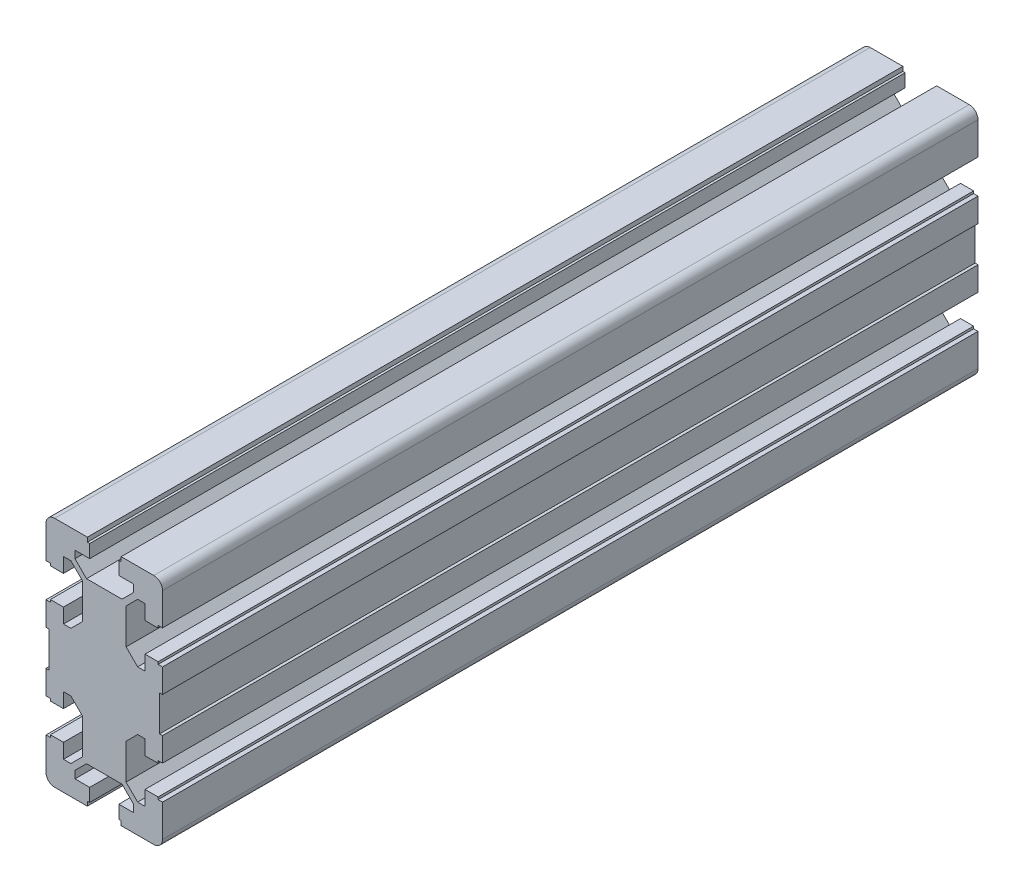
from build123d import *

# Parameters (mm, degrees)
EXTRUDE1_DEPTH      = 200
BOSS_EXTRUDE1_START = 80
BOSS_EXTRUDE1_DEPTH = 80


with BuildPart() as part:
    # Sketch1 → Extrude1 (new body)
    with BuildSketch(Plane.XY):
        with BuildLine():
            Line((19, -6.108412677), (20, -6.108412677))
            Line((20, -6.108412677), (20, -14.308412677))
            Line((20, -14.308412677), (18.5, -14.308412677))
            Line((18.5, -14.308412677), (18.5, -15.108412677))
            Line((18.5, -15.108412677), (14, -15.108412677))
            Line((14, -15.108412677), (14, -10.058412677))
            Line((14, -10.058412677), (11.464213562, -10.058412677))
            Line((11.464213562, -10.058412677), (7.5, -14.02262624))
            Line((7.5, -14.02262624), (7.5, -26.194199115))
            Line((7.5, -26.194199115), (11.464213562, -30.158412677))
            Line((11.464213562, -30.158412677), (14, -30.158412677))
            Line((14, -30.158412677), (14, -25.108412677))
            Line((14, -25.108412677), (18.5, -25.108412677))
            Line((18.5, -25.108412677), (18.5, -25.908412677))
            Line((18.5, -25.908412677), (20, -25.908412677))
            Line((20, -25.908412677), (20, -37))
            ThreePointArc((20, -37), (19.121320344, -39.121320344), (17, -40))
            Line((17, -40), (5.8, -40))
            Line((5.8, -40), (5.8, -38.5))
            Line((5.8, -38.5), (5, -38.5))
            Line((5, -38.5), (5, -34))
            Line((5, -34), (10.05, -34))
            Line((10.05, -34), (10.05, -31.464213562))
            Line((10.05, -31.464213562), (6.085786438, -27.5))
            Line((6.085786438, -27.5), (-6.085786438, -27.5))
            Line((-6.085786438, -27.5), (-10.05, -31.464213562))
            Line((-10.05, -31.464213562), (-10.05, -34))
            Line((-10.05, -34), (-5, -34))
            Line((-5, -34), (-5, -38.5))
            Line((-5, -38.5), (-5.8, -38.5))
            Line((-5.8, -38.5), (-5.8, -40))
            Line((-5.8, -40), (-17, -40))
            ThreePointArc((-17, -40), (-19.121320344, -39.121320344), (-20, -37))
            Line((-20, -37), (-20, -25.908412677))
            Line((-20, -25.908412677), (-18.5, -25.908412677))
            Line((-18.5, -25.908412677), (-18.5, -25.108412677))
            Line((-18.5, -25.108412677), (-14, -25.108412677))
            Line((-14, -25.108412677), (-14, -30.158412677))
            Line((-14, -30.158412677), (-11.464213562, -30.158412677))
            Line((-11.464213562, -30.158412677), (-7.5, -26.194199115))
            Line((-7.5, -26.194199115), (-7.5, -14.02262624))
            Line((-7.5, -14.02262624), (-11.464213562, -10.058412677))
            Line((-11.464213562, -10.058412677), (-14, -10.058412677))
            Line((-14, -10.058412677), (-14, -15.108412677))
            Line((-14, -15.108412677), (-18.5, -15.108412677))
            Line((-18.5, -15.108412677), (-18.5, -14.308412677))
            Line((-18.5, -14.308412677), (-20, -14.308412677))
            Line((-20, -14.308412677), (-20, -6.108412677))
            Line((-20, -6.108412677), (-19, -6.108412677))
            Line((-19, -6.108412677), (-19, 6.108412677))
            Line((-19, 6.108412677), (-20, 6.108412677))
            Line((-20, 6.108412677), (-20, 14.308412677))
            Line((-20, 14.308412677), (-18.5, 14.308412677))
            Line((-18.5, 14.308412677), (-18.5, 15.108412677))
            Line((-18.5, 15.108412677), (-14, 15.108412677))
            Line((-14, 15.108412677), (-14, 10.058412677))
            Line((-14, 10.058412677), (-11.464213562, 10.058412677))
            Line((-11.464213562, 10.058412677), (-7.5, 14.02262624))
            Line((-7.5, 14.02262624), (-7.5, 26.194199115))
            Line((-7.5, 26.194199115), (-11.464213562, 30.158412677))
            Line((-11.464213562, 30.158412677), (-14, 30.158412677))
            Line((-14, 30.158412677), (-14, 25.108412677))
            Line((-14, 25.108412677), (-18.5, 25.108412677))
            Line((-18.5, 25.108412677), (-18.5, 25.908412677))
            Line((-18.5, 25.908412677), (-20, 25.908412677))
            Line((-20, 25.908412677), (-20, 37))
            ThreePointArc((-20, 37), (-19.121320344, 39.121320344), (-17, 40))
            Line((-17, 40), (-5.8, 40))
            Line((-5.8, 40), (-5.8, 38.5))
            Line((-5.8, 38.5), (-5, 38.5))
            Line((-5, 38.5), (-5, 34))
            Line((-5, 34), (-10.05, 34))
            Line((-10.05, 34), (-10.05, 31.464213562))
            Line((-10.05, 31.464213562), (-6.085786438, 27.5))
            Line((-6.085786438, 27.5), (6.085786438, 27.5))
            Line((6.085786438, 27.5), (10.05, 31.464213562))
            Line((10.05, 31.464213562), (10.05, 34))
            Line((10.05, 34), (5, 34))
            Line((5, 34), (5, 38.5))
            Line((5, 38.5), (5.8, 38.5))
            Line((5.8, 38.5), (5.8, 40))
            Line((5.8, 40), (17, 40))
            ThreePointArc((17, 40), (19.121320344, 39.121320344), (20, 37))
            Line((20, 37), (20, 25.908412677))
            Line((20, 25.908412677), (18.5, 25.908412677))
            Line((18.5, 25.908412677), (18.5, 25.108412677))
            Line((18.5, 25.108412677), (14, 25.108412677))
            Line((14, 25.108412677), (14, 30.158412677))
            Line((14, 30.158412677), (11.464213562, 30.158412677))
            Line((11.464213562, 30.158412677), (7.5, 26.194199115))
            Line((7.5, 26.194199115), (7.5, 14.02262624))
            Line((7.5, 14.02262624), (11.464213562, 10.058412677))
            Line((11.464213562, 10.058412677), (14, 10.058412677))
            Line((14, 10.058412677), (14, 15.108412677))
            Line((14, 15.108412677), (18.5, 15.108412677))
            Line((18.5, 15.108412677), (18.5, 14.308412677))
            Line((18.5, 14.308412677), (20, 14.308412677))
            Line((20, 14.308412677), (20, 6.108412677))
            Line((20, 6.108412677), (19, 6.108412677))
            Line((19, 6.108412677), (19, -6.108412677))
        make_face()
        Polygon((10.635786438, -8.058412677), (17, -8.058412677), (17, 8.058412677), (10.635786438, 8.058412677), (6.085786438, 12.608412677), (-6.085786438, 12.608412677), (-10.635786438, 8.058412677), (-17, 8.058412677), (-17, -8.058412677), (-10.635786438, -8.058412677), (-6.085786438, -12.608412677), (6.085786438, -12.608412677), align=None, mode=Mode.SUBTRACT)
        with BuildLine():
            Line((-18.5, -34.608412677), (-18.5, -29.608412677))
            ThreePointArc((-18.5, -29.608412677), (-17, -28.108412677), (-15.5, -29.608412677))
            Line((-15.5, -29.608412677), (-15.5, -31.858412677))
            Line((-15.5, -31.858412677), (-14.5, -31.858412677))
            ThreePointArc((-14.5, -31.858412677), (-12.555456352, -32.663869029), (-11.75, -34.608412677))
            Line((-11.75, -34.608412677), (-11.75, -35.608412677))
            Line((-11.75, -35.608412677), (-9.5, -35.608412677))
            ThreePointArc((-9.5, -35.608412677), (-8, -37.108412677), (-9.5, -38.608412677))
            Line((-9.5, -38.608412677), (-14.5, -38.608412677))
            Line((-14.5, -38.608412677), (-14.5, -37.358412677))
            ThreePointArc((-14.5, -37.358412677), (-16.444543648, -36.552956325), (-17.25, -34.608412677))
            Line((-17.25, -34.608412677), (-18.5, -34.608412677))
        make_face(mode=Mode.SUBTRACT)
        with BuildLine():
            Line((5.5, -14.608412677), (2.397915762, -14.608412677))
            Line((2.397915762, -14.608412677), (1.998263135, -15.525079344))
            ThreePointArc((1.998263135, -15.525079344), (0, -15.108412677), (-1.998263135, -15.525079344))
            Line((-1.998263135, -15.525079344), (-2.397915762, -14.608412677))
            Line((-2.397915762, -14.608412677), (-5.5, -14.608412677))
            Line((-5.5, -14.608412677), (-5.5, -17.710496916))
            Line((-5.5, -17.710496916), (-4.583333333, -18.110149542))
            ThreePointArc((-4.583333333, -18.110149542), (-5, -20.108412677), (-4.583333333, -22.106675812))
            Line((-4.583333333, -22.106675812), (-5.5, -22.506328439))
            Line((-5.5, -22.506328439), (-5.5, -25.608412677))
            Line((-5.5, -25.608412677), (-2.397915762, -25.608412677))
            Line((-2.397915762, -25.608412677), (-1.998263135, -24.691746011))
            ThreePointArc((-1.998263135, -24.691746011), (0, -25.108412677), (1.998263135, -24.691746011))
            Line((1.998263135, -24.691746011), (2.397915762, -25.608412677))
            Line((2.397915762, -25.608412677), (5.5, -25.608412677))
            Line((5.5, -25.608412677), (5.5, -22.506328439))
            Line((5.5, -22.506328439), (4.583333333, -22.106675812))
            ThreePointArc((4.583333333, -22.106675812), (5, -20.108412677), (4.583333333, -18.110149542))
            Line((4.583333333, -18.110149542), (5.5, -17.710496916))
            Line((5.5, -17.710496916), (5.5, -14.608412677))
        make_face(mode=Mode.SUBTRACT)
        with BuildLine():
            Line((15.5, -31.858412677), (14.5, -31.858412677))
            ThreePointArc((14.5, -31.858412677), (12.555456352, -32.663869029), (11.75, -34.608412677))
            Line((11.75, -34.608412677), (11.75, -35.608412677))
            Line((11.75, -35.608412677), (9.5, -35.608412677))
            ThreePointArc((9.5, -35.608412677), (8, -37.108412677), (9.5, -38.608412677))
            Line((9.5, -38.608412677), (14.5, -38.608412677))
            Line((14.5, -38.608412677), (14.5, -37.358412677))
            ThreePointArc((14.5, -37.358412677), (16.444543648, -36.552956325), (17.25, -34.608412677))
            Line((17.25, -34.608412677), (18.5, -34.608412677))
            Line((18.5, -34.608412677), (18.5, -29.608412677))
            ThreePointArc((18.5, -29.608412677), (17, -28.108412677), (15.5, -29.608412677))
            Line((15.5, -29.608412677), (15.5, -31.858412677))
        make_face(mode=Mode.SUBTRACT)
        with BuildLine():
            Line((18.5, 34.608412677), (18.5, 29.608412677))
            ThreePointArc((18.5, 29.608412677), (17, 28.108412677), (15.5, 29.608412677))
            Line((15.5, 29.608412677), (15.5, 31.858412677))
            Line((15.5, 31.858412677), (14.5, 31.858412677))
            ThreePointArc((14.5, 31.858412677), (12.555456352, 32.663869029), (11.75, 34.608412677))
            Line((11.75, 34.608412677), (11.75, 35.608412677))
            Line((11.75, 35.608412677), (9.5, 35.608412677))
            ThreePointArc((9.5, 35.608412677), (8, 37.108412677), (9.5, 38.608412677))
            Line((9.5, 38.608412677), (14.5, 38.608412677))
            Line((14.5, 38.608412677), (14.5, 37.358412677))
            ThreePointArc((14.5, 37.358412677), (16.444543648, 36.552956325), (17.25, 34.608412677))
            Line((17.25, 34.608412677), (18.5, 34.608412677))
        make_face(mode=Mode.SUBTRACT)
        with BuildLine():
            Line((-5.5, 14.608412677), (-2.397915762, 14.608412677))
            Line((-2.397915762, 14.608412677), (-1.998263135, 15.525079344))
            ThreePointArc((-1.998263135, 15.525079344), (0, 15.108412677), (1.998263135, 15.525079344))
            Line((1.998263135, 15.525079344), (2.397915762, 14.608412677))
            Line((2.397915762, 14.608412677), (5.5, 14.608412677))
            Line((5.5, 14.608412677), (5.5, 17.710496916))
            Line((5.5, 17.710496916), (4.583333333, 18.110149542))
            ThreePointArc((4.583333333, 18.110149542), (5, 20.108412677), (4.583333333, 22.106675812))
            Line((4.583333333, 22.106675812), (5.5, 22.506328439))
            Line((5.5, 22.506328439), (5.5, 25.608412677))
            Line((5.5, 25.608412677), (2.397915762, 25.608412677))
            Line((2.397915762, 25.608412677), (1.998263135, 24.691746011))
            ThreePointArc((1.998263135, 24.691746011), (0, 25.108412677), (-1.998263135, 24.691746011))
            Line((-1.998263135, 24.691746011), (-2.397915762, 25.608412677))
            Line((-2.397915762, 25.608412677), (-5.5, 25.608412677))
            Line((-5.5, 25.608412677), (-5.5, 22.506328439))
            Line((-5.5, 22.506328439), (-4.583333333, 22.106675812))
            ThreePointArc((-4.583333333, 22.106675812), (-5, 20.108412677), (-4.583333333, 18.110149542))
            Line((-4.583333333, 18.110149542), (-5.5, 17.710496916))
            Line((-5.5, 17.710496916), (-5.5, 14.608412677))
        make_face(mode=Mode.SUBTRACT)
        with BuildLine():
            Line((-15.5, 31.858412677), (-14.5, 31.858412677))
            ThreePointArc((-14.5, 31.858412677), (-12.555456352, 32.663869029), (-11.75, 34.608412677))
            Line((-11.75, 34.608412677), (-11.75, 35.608412677))
            Line((-11.75, 35.608412677), (-9.5, 35.608412677))
            ThreePointArc((-9.5, 35.608412677), (-8, 37.108412677), (-9.5, 38.608412677))
            Line((-9.5, 38.608412677), (-14.5, 38.608412677))
            Line((-14.5, 38.608412677), (-14.5, 37.358412677))
            ThreePointArc((-14.5, 37.358412677), (-16.444543648, 36.552956325), (-17.25, 34.608412677))
            Line((-17.25, 34.608412677), (-18.5, 34.608412677))
            Line((-18.5, 34.608412677), (-18.5, 29.608412677))
            ThreePointArc((-18.5, 29.608412677), (-17, 28.108412677), (-15.5, 29.608412677))
            Line((-15.5, 29.608412677), (-15.5, 31.858412677))
        make_face(mode=Mode.SUBTRACT)
    extrude(amount=-EXTRUDE1_DEPTH)

    # Sketch2 → Boss-Extrude1 (add)
    with BuildSketch(Plane.XY.offset(BOSS_EXTRUDE1_START)):
        with BuildLine():
            Line((-17, -40), (-5.8, -40))
            Line((-5.8, -40), (-5.8, -38.5))
            Line((-5.8, -38.5), (-5, -38.5))
            Line((-5, -38.5), (-5, -34))
            Line((-5, -34), (-10.05, -34))
            Line((-10.05, -34), (-10.05, -31.464213562))
            Line((-10.05, -31.464213562), (-6.085786438, -27.5))
            Line((-6.085786438, -27.5), (6.085786438, -27.5))
            Line((6.085786438, -27.5), (10.05, -31.464213562))
            Line((10.05, -31.464213562), (10.05, -34))
            Line((10.05, -34), (5, -34))
            Line((5, -34), (5, -38.5))
            Line((5, -38.5), (5.8, -38.5))
            Line((5.8, -38.5), (5.8, -40))
            Line((5.8, -40), (17, -40))
            ThreePointArc((17, -40), (19.121320344, -39.121320344), (20, -37))
            Line((20, -37), (20, -25.908412677))
            Line((20, -25.908412677), (18.5, -25.908412677))
            Line((18.5, -25.908412677), (18.5, -25.108412677))
            Line((18.5, -25.108412677), (14, -25.108412677))
            Line((14, -25.108412677), (14, -30.158412677))
            Line((14, -30.158412677), (11.464213562, -30.158412677))
            Line((11.464213562, -30.158412677), (7.5, -26.194199115))
            Line((7.5, -26.194199115), (7.5, -14.02262624))
            Line((7.5, -14.02262624), (11.464213562, -10.058412677))
            Line((11.464213562, -10.058412677), (14, -10.058412677))
            Line((14, -10.058412677), (14, -15.108412677))
            Line((14, -15.108412677), (18.5, -15.108412677))
            Line((18.5, -15.108412677), (18.5, -14.308412677))
            Line((18.5, -14.308412677), (20, -14.308412677))
            Line((20, -14.308412677), (20, -6.108412677))
            Line((20, -6.108412677), (19, -6.108412677))
            Line((19, -6.108412677), (19, 6.108412677))
            Line((19, 6.108412677), (20, 6.108412677))
            Line((20, 6.108412677), (20, 14.308412677))
            Line((20, 14.308412677), (18.5, 14.308412677))
            Line((18.5, 14.308412677), (18.5, 15.108412677))
            Line((18.5, 15.108412677), (14, 15.108412677))
            Line((14, 15.108412677), (14, 10.058412677))
            Line((14, 10.058412677), (11.464213562, 10.058412677))
            Line((11.464213562, 10.058412677), (7.5, 14.02262624))
            Line((7.5, 14.02262624), (7.5, 26.194199115))
            Line((7.5, 26.194199115), (11.464213562, 30.158412677))
            Line((11.464213562, 30.158412677), (14, 30.158412677))
            Line((14, 30.158412677), (14, 25.108412677))
            Line((14, 25.108412677), (18.5, 25.108412677))
            Line((18.5, 25.108412677), (18.5, 25.908412677))
            Line((18.5, 25.908412677), (20, 25.908412677))
            Line((20, 25.908412677), (20, 37))
            ThreePointArc((20, 37), (19.121320344, 39.121320344), (17, 40))
            Line((17, 40), (5.8, 40))
            Line((5.8, 40), (5.8, 38.5))
            Line((5.8, 38.5), (5, 38.5))
            Line((5, 38.5), (5, 34))
            Line((5, 34), (10.05, 34))
            Line((10.05, 34), (10.05, 31.464213562))
            Line((10.05, 31.464213562), (6.085786438, 27.5))
            Line((6.085786438, 27.5), (-6.085786438, 27.5))
            Line((-6.085786438, 27.5), (-10.05, 31.464213562))
            Line((-10.05, 31.464213562), (-10.05, 34))
            Line((-10.05, 34), (-5, 34))
            Line((-5, 34), (-5, 38.5))
            Line((-5, 38.5), (-5.8, 38.5))
            Line((-5.8, 38.5), (-5.8, 40))
            Line((-5.8, 40), (-17, 40))
            ThreePointArc((-17, 40), (-19.121320344, 39.121320344), (-20, 37))
            Line((-20, 37), (-20, 25.908412677))
            Line((-20, 25.908412677), (-18.5, 25.908412677))
            Line((-18.5, 25.908412677), (-18.5, 25.108412677))
            Line((-18.5, 25.108412677), (-14, 25.108412677))
            Line((-14, 25.108412677), (-14, 30.158412677))
            Line((-14, 30.158412677), (-11.464213562, 30.158412677))
            Line((-11.464213562, 30.158412677), (-7.5, 26.194199115))
            Line((-7.5, 26.194199115), (-7.5, 14.02262624))
            Line((-7.5, 14.02262624), (-11.464213562, 10.058412677))
            Line((-11.464213562, 10.058412677), (-14, 10.058412677))
            Line((-14, 10.058412677), (-14, 15.108412677))
            Line((-14, 15.108412677), (-18.5, 15.108412677))
            Line((-18.5, 15.108412677), (-18.5, 14.308412677))
            Line((-18.5, 14.308412677), (-20, 14.308412677))
            Line((-20, 14.308412677), (-20, 6.108412677))
            Line((-20, 6.108412677), (-19, 6.108412677))
            Line((-19, 6.108412677), (-19, -6.108412677))
            Line((-19, -6.108412677), (-20, -6.108412677))
            Line((-20, -6.108412677), (-20, -14.308412677))
            Line((-20, -14.308412677), (-18.5, -14.308412677))
            Line((-18.5, -14.308412677), (-18.5, -15.108412677))
            Line((-18.5, -15.108412677), (-14, -15.108412677))
            Line((-14, -15.108412677), (-14, -10.058412677))
            Line((-14, -10.058412677), (-11.464213562, -10.058412677))
            Line((-11.464213562, -10.058412677), (-7.5, -14.02262624))
            Line((-7.5, -14.02262624), (-7.5, -26.194199115))
            Line((-7.5, -26.194199115), (-11.464213562, -30.158412677))
            Line((-11.464213562, -30.158412677), (-14, -30.158412677))
            Line((-14, -30.158412677), (-14, -25.108412677))
            Line((-14, -25.108412677), (-18.5, -25.108412677))
            Line((-18.5, -25.108412677), (-18.5, -25.908412677))
            Line((-18.5, -25.908412677), (-20, -25.908412677))
            Line((-20, -25.908412677), (-20, -37))
            ThreePointArc((-20, -37), (-19.121320344, -39.121320344), (-17, -40))
        make_face()
    extrude(amount=-BOSS_EXTRUDE1_DEPTH)


solid = part.part
